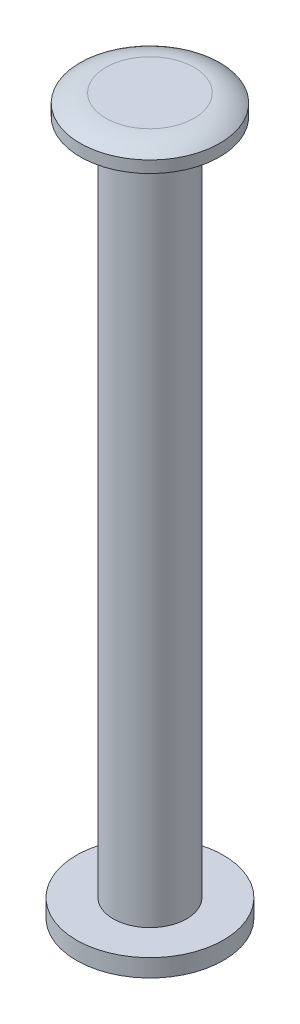
from build123d import *


with BuildPart() as part:
    # 草图1 → 旋转1 (revolve)
    with BuildSketch(Plane.XY, mode=Mode.PRIVATE) as revolve_1_sk:
        with BuildLine():
            Line((0, 1.9), (0, 0))
            Line((0, 0), (3, 0))
            ThreePointArc((3, 0), (4.059481005, 0.180054271), (5, 0.7))
            Line((5, 0.7), (5, 1.9))
            Line((5, 1.9), (2.5, 1.9))
            Line((2.5, 1.9), (2.5, 46.9))
            Line((2.5, 46.9), (2, 46.9))
            Line((2, 46.9), (2, 1.9))
            Line((2, 1.9), (0, 1.9))
        make_face()
    revolve(revolve_1_sk.sketch.rotate(Axis((0, 8.469919731, 0), (0, -1, 0)), 90), axis=Axis((0, 8.469919731, 0), (0, -1, 0)))


with BuildPart() as body_2:
    # 草图2 → 旋转2 (revolve)
    with BuildSketch(Plane.XY, mode=Mode.PRIVATE) as revolve_2_sk:
        with BuildLine():
            Line((0, 43.9), (0, 49.3))
            Line((0, 49.3), (-3, 49.3))
            ThreePointArc((-3, 49.3), (-3.925, 49.145833333), (-4.75, 48.7))
            Line((-4.75, 48.7), (-4.75, 47.9))
            Line((-4.75, 47.9), (-1.95, 47.9))
            Line((-1.95, 47.9), (-1.95, 43.9))
            Line((-1.95, 43.9), (0, 43.9))
        make_face()
    revolve(revolve_2_sk.sketch.rotate(Axis((0, -6.2562109, 0), (0, 1, 0)), 270), axis=Axis((0, -6.2562109, 0), (0, 1, 0)))


solid = Compound([part.part, body_2.part])
